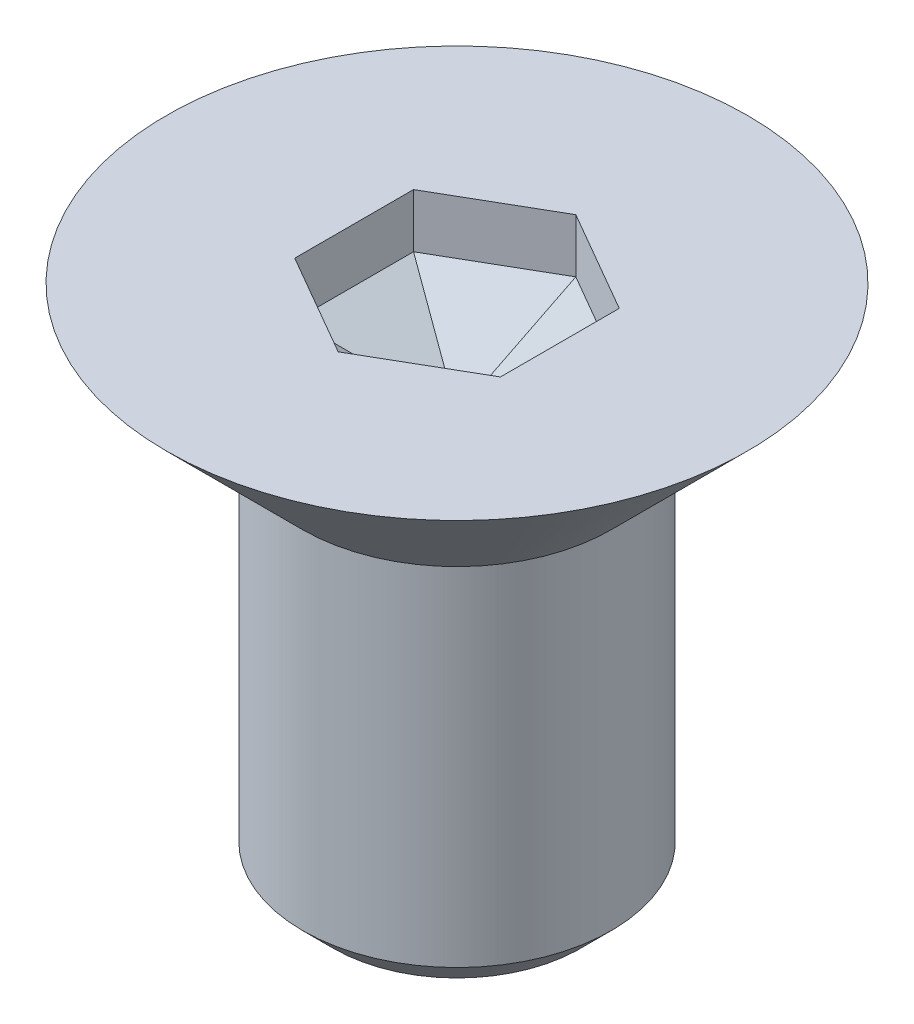
from build123d import *
from OCP.BRepFilletAPI import BRepFilletAPI_MakeChamfer

# Parameters (mm, degrees)
SKETCH_4_R          = 3
EXTRUDE_2_DEPTH     = 10
CUT_EXTRUDE_1_DEPTH = 2.2
CHAMFER_3_SIZE      = 1.152737752
CHAMFER_3_SIZE2     = 1.996600355
CHAMFER_4_SIZE      = 0.6


with BuildPart() as part:
    # 草图2 → 旋转1 (revolve)
    with BuildSketch(Plane.XY):
        Polygon((0, -3.72), (0, 0), (5.65, 0), (1.93, -3.72), align=None)
    revolve(axis=Axis((0, -3.72, 0), (0, 1, 0)))

    # 草图4 → 凸台-拉伸2 (add)
    with BuildSketch(Plane.XZ):
        Circle(SKETCH_4_R)
    extrude(amount=EXTRUDE_2_DEPTH)

    # 草图3 → 切除-拉伸1 (cut)
    with BuildSketch(Plane(origin=(0, 0, 0), x_dir=(1, 0, 0), z_dir=(0, 1, 0))):
        Polygon((2, 1.154700538), (0, 2.309401077), (-2, 1.154700538), (-2, -1.154700538), (0, -2.309401077), (2, -1.154700538), align=None)
    extrude(amount=-CUT_EXTRUDE_1_DEPTH, mode=Mode.SUBTRACT)

    # 倒角3: one chamfer whose edges measure the first distance from different faces: ONE call of the kernel's chamfer builder (chamfer() names one face for all edges)
    chamfer_3_edges_1 = [part.edges().sort_by_distance(p)[0] for p in [
        (-1, -2.2, 1.732050808),
    ]]
    chamfer_3_side_1 = [part.faces().sort_by_distance(p)[0] for p in [
        (-1, -1.1, 1.732050808),
    ]]
    chamfer_3_edges_2 = [part.edges().sort_by_distance(p)[0] for p in [
        (-2, -2.2, 0),
    ]]
    chamfer_3_side_2 = [part.faces().sort_by_distance(p)[0] for p in [
        (-2, -1.1, 0),
    ]]
    chamfer_3_edges_3 = [part.edges().sort_by_distance(p)[0] for p in [
        (-1, -2.2, -1.732050808),
    ]]
    chamfer_3_side_3 = [part.faces().sort_by_distance(p)[0] for p in [
        (-1, -1.1, -1.732050808),
    ]]
    chamfer_3_edges_4 = [part.edges().sort_by_distance(p)[0] for p in [
        (1, -2.2, -1.732050808),
    ]]
    chamfer_3_side_4 = [part.faces().sort_by_distance(p)[0] for p in [
        (1, -1.1, -1.732050808),
    ]]
    chamfer_3_edges_5 = [part.edges().sort_by_distance(p)[0] for p in [
        (2, -2.2, 0),
    ]]
    chamfer_3_side_5 = [part.faces().sort_by_distance(p)[0] for p in [
        (2, -1.1, 0),
    ]]
    chamfer_3_edges_6 = [part.edges().sort_by_distance(p)[0] for p in [
        (1, -2.2, 1.732050808),
    ]]
    chamfer_3_side_6 = [part.faces().sort_by_distance(p)[0] for p in [
        (1, -1.1, 1.732050808),
    ]]
    chamfer_3 = BRepFilletAPI_MakeChamfer(part.part.solid().wrapped)
    for e in chamfer_3_edges_1:
        chamfer_3.Add(CHAMFER_3_SIZE, CHAMFER_3_SIZE2, e.wrapped, chamfer_3_side_1[0].wrapped)  # the first distance lies on this face
    for e in chamfer_3_edges_2:
        chamfer_3.Add(CHAMFER_3_SIZE, CHAMFER_3_SIZE2, e.wrapped, chamfer_3_side_2[0].wrapped)  # the first distance lies on this face
    for e in chamfer_3_edges_3:
        chamfer_3.Add(CHAMFER_3_SIZE, CHAMFER_3_SIZE2, e.wrapped, chamfer_3_side_3[0].wrapped)  # the first distance lies on this face
    for e in chamfer_3_edges_4:
        chamfer_3.Add(CHAMFER_3_SIZE, CHAMFER_3_SIZE2, e.wrapped, chamfer_3_side_4[0].wrapped)  # the first distance lies on this face
    for e in chamfer_3_edges_5:
        chamfer_3.Add(CHAMFER_3_SIZE, CHAMFER_3_SIZE2, e.wrapped, chamfer_3_side_5[0].wrapped)  # the first distance lies on this face
    for e in chamfer_3_edges_6:
        chamfer_3.Add(CHAMFER_3_SIZE, CHAMFER_3_SIZE2, e.wrapped, chamfer_3_side_6[0].wrapped)  # the first distance lies on this face
    add(Compound.cast(chamfer_3.Shape()), mode=Mode.REPLACE)

    # 倒角4
    chamfer_4_edges = [part.edges().sort_by_distance(p)[0] for p in [
        (-3, -10, 0),
    ]]
    chamfer(chamfer_4_edges, length=CHAMFER_4_SIZE)


solid = part.part
